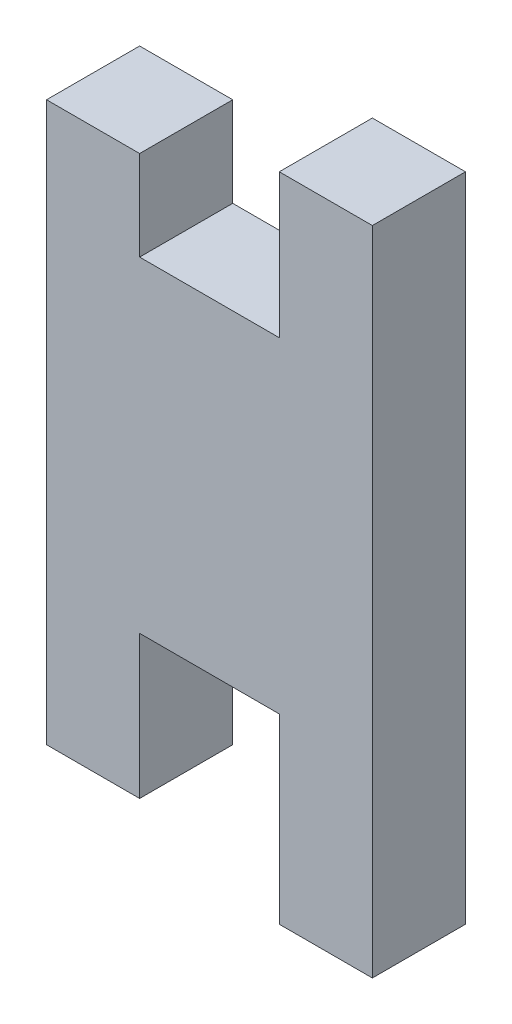
from build123d import *

# Parameters (mm, degrees)
BOSS_EXTRU_2_DEPTH = 10


with BuildPart() as part:
    # Esquisse3 → Boss.-Extru.2 (new body)
    with BuildSketch(Plane.XY):
        Polygon((0, 0), (10, 0), (10, -9.636678201), (25, -9.636678201), (25, 5.799844247), (35, 5.799844247), (35, -64.200155753), (25, -64.200155753), (25, -44.636678201), (10, -44.636678201), (10, -60), (0, -60), align=None)
    extrude(amount=-BOSS_EXTRU_2_DEPTH)


solid = part.part
